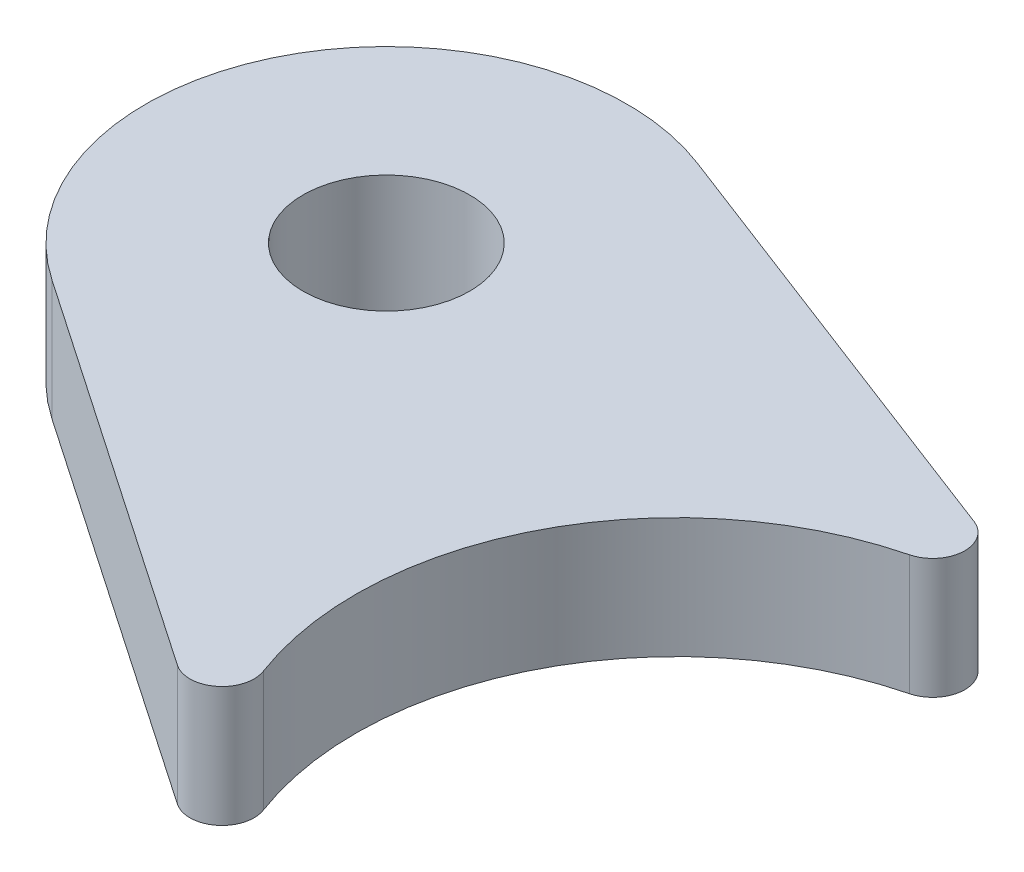
from build123d import *

# Parameters (mm, degrees)
BOSS_EXTRUDE1_DEPTH  = 4.7625
FILLET1_R            = 1.27
M6_CLEARANCE_HOLE1_D = 6.6


with BuildPart() as part:
    # Sketch1 → Boss-Extrude1 (new body)
    with BuildSketch(Plane(origin=(0, 0, 0), x_dir=(1, 0, 0), z_dir=(0, 1, 0))):
        with BuildLine():
            Line((-29.505035319724954, 4.784524777155699), (-7.166713759633276, -10.484665654539652))
            ThreePointArc((-7.166713759633276, -10.484665654539652), (-11.24843137291464, 5.895997934941107), (4.544931572497542, 11.8589037014943))
            Line((4.544931572497542, 11.8589037014943), (-20.721301320626843, 21.542201794181164))
            ThreePointArc((-20.721301320626843, 21.542201794181164), (-32.56632352968598, 17.07002246926627), (-29.505035319724954, 4.784524777155699))
        make_face()
    extrude(amount=BOSS_EXTRUDE1_DEPTH)

    # Fillet1
    fillet1_edges = [part.edges().sort_by_distance(p)[0] for p in [
        (4.544931572497541, 2.38125, -11.858903701494302),
        (-7.166713759633276, 2.38125, 10.484665654539652),
    ]]
    fillet(fillet1_edges, radius=FILLET1_R)

    # M6 Clearance Hole1 (through all)
    with Locations(Plane(origin=(0, 4.7625, 0), x_dir=(1, 0, 0), z_dir=(0, 1, 0))):
        with Locations((-24.13, 12.648024018)):
            Hole(M6_CLEARANCE_HOLE1_D / 2)


solid = part.part
